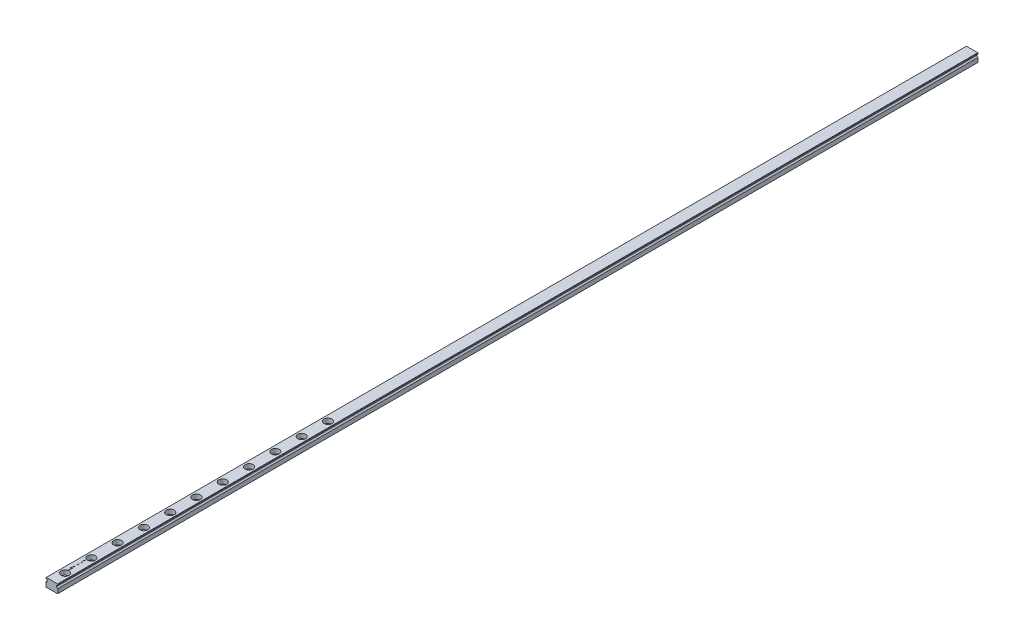
from build123d import *

# Parameters (mm, degrees)
EXTRUDE_1_DEPTH              = 220
HOLE_WIZARD_M3_1_D           = 3.5
HOLE_WIZARD_M3_1_CBORE_D     = 6
HOLE_WIZARD_M3_1_CBORE_DEPTH = 3.5
PATTERN_LINEAR_1_COUNT       = 11
PATTERN_LINEAR_1_PITCH       = 20
SKETCH_6_W                   = 1.5
SKETCH_6_H                   = 0.134615385
CUT_EXTRUDE_1_DEPTH          = 0.1
EXTRUDE_2_DEPTH              = 480


with BuildPart() as part:
    # 草图1 → 凸台-拉伸1 (new body)
    with BuildSketch(Plane.XY):
        with BuildLine():
            Line((4.5, 5.5), (4.5, 6.3))
            Line((4.5, 6.3), (4.3, 6.5))
            Line((4.3, 6.5), (-4.3, 6.5))
            Line((-4.3, 6.5), (-4.5, 6.3))
            Line((-4.5, 6.3), (-4.5, 5.5))
            ThreePointArc((-4.5, 5.5), (-3.5, 4.5), (-4.5, 3.5))
            Line((-4.5, 3.5), (-4.5, 0.2))
            Line((-4.5, 0.2), (-4.3, 0))
            Line((-4.3, 0), (0.2, 0))
            ThreePointArc((0.2, 0), (0.5, 0.3), (0.8, 0))
            Line((0.8, 0), (4.3, 0))
            Line((4.3, 0), (4.5, 0.2))
            Line((4.5, 0.2), (4.5, 3.5))
            ThreePointArc((4.5, 3.5), (3.5, 4.5), (4.5, 5.5))
        make_face()
    extrude(amount=-EXTRUDE_1_DEPTH)

    # M3 六角凹头螺钉的柱形沉头孔1 (through all)
    with Locations(Plane(origin=(0.754900713, 6.5, 19.343475793), x_dir=(-1, 0, 0), z_dir=(0, 1, 0))):
        with Locations((0.754900713, -29.343475793)):
            hole_wizard_m3_1 = CounterBoreHole(HOLE_WIZARD_M3_1_D / 2, HOLE_WIZARD_M3_1_CBORE_D / 2, HOLE_WIZARD_M3_1_CBORE_DEPTH)

    # 阵列(线性)1: M3 六角凹头螺钉的柱形沉头孔1 ×11
    with Locations(*[(0, 0, -i * PATTERN_LINEAR_1_PITCH) for i in range(1, PATTERN_LINEAR_1_COUNT)]):
        add(hole_wizard_m3_1, mode=Mode.SUBTRACT)

    # 草图6 → 切除-拉伸1 (cut)
    # profile 1 of 9: a face of its own
    with BuildSketch(Plane(origin=(0, 6.5, 0), x_dir=(1, 0, 0), z_dir=(0, 1, 0))):
        Polygon((-1.5, 13.740384615), (-1.5, 13.875), (-0.884615385, 13.875), (-0.884615385, 14.644230769), (-1.5, 14.644230769), (-1.5, 14.778846154), (0, 14.778846154), (0, 14.644230769), (-0.730769231, 14.644230769), (-0.730769231, 13.875), (0, 13.875), (0, 13.740384615), align=None)
    # profile 2 of 9: a face of its own
    with BuildSketch(Plane(origin=(0, 6.5, 0), x_dir=(1, 0, 0), z_dir=(0, 1, 0))):
        with Locations((-0.75, 15.230769231)):
            Rectangle(SKETCH_6_W, SKETCH_6_H)
    # profile 3 of 9: a face of its own
    with BuildSketch(Plane(origin=(0, 6.5, 0), x_dir=(1, 0, 0), z_dir=(0, 1, 0))):
        Polygon((-1.5, 15.528846154), (-1.5, 15.66796875), (-0.399939904, 15.961538462), (-1.5, 16.398137019), (-1.5, 16.417668269), (-0.407451923, 16.846153846), (-1.5, 17.141225962), (-1.5, 17.278846154), (0, 16.874399038), (0, 16.855168269), (-1.147235577, 16.403846154), (0, 15.947115385), (0, 15.927884615), align=None)
    # profile 4 of 9: a face of its own
    with BuildSketch(Plane(origin=(0, 6.5, 0), x_dir=(1, 0, 0), z_dir=(0, 1, 0))):
        with Locations((-0.75, 17.692307693)):
            Rectangle(SKETCH_6_W, SKETCH_6_H)
    # profile 5 of 9: a face of its own
    with BuildSketch(Plane(origin=(0, 6.5, 0), x_dir=(1, 0, 0), z_dir=(0, 1, 0))):
        Polygon((0, 18.086538462), (-1.5, 18.086538462), (-1.5, 18.114783654), (-0.319411058, 19.105769231), (-1.5, 19.105769231), (-1.5, 19.240384615), (0, 19.240384615), (0, 19.209735577), (-1.177884615, 18.221153846), (0, 18.221153846), align=None)
    # profile 6 of 9: a face of its own
    with BuildSketch(Plane(origin=(0, 6.5, 0), x_dir=(1, 0, 0), z_dir=(0, 1, 0))):
        Polygon((0, 20.125), (-1.5, 20.323016827), (-1.5, 20.342247596), (-0.269230769, 20.961538462), (-1.5, 21.579326923), (-1.5, 21.598858173), (0, 21.798076923), (0, 21.662860577), (-1.079326923, 21.519230769), (0, 20.977764423), (0, 20.947415865), (-1.081730769, 20.403846154), (0, 20.260516827), align=None)
    # profile 7 of 9: a face of its own
    with BuildSketch(Plane(origin=(0, 6.5, 0), x_dir=(1, 0, 0), z_dir=(0, 1, 0))):
        with BuildLine():
            Line((-1.243990385, 23.509615385), (-1.134615385, 23.394230769))
            add(Edge.make_bspline(
                [(-1.134615385, 23.394230769), (-1.154263766, 23.373355449), (-1.193092001, 23.332102593), (-1.243390317, 23.264731189), (-1.28690443, 23.194721537), (-1.322045397, 23.121960438), (-1.349611823, 23.048355866), (-1.369650093, 22.975173457), (-1.382340162, 22.902887044), (-1.383864341, 22.854816629), (-1.384615385, 22.831129808)],
                knots=[0, 0, 0, 0, 1.089067066, 2.152164705, 3.18986567, 4.218445106, 5.218487318, 6.173592265, 7.100032889, 8, 8, 8, 8], degree=3))
            add(Edge.make_bspline(
                [(-1.384615385, 22.831129808), (-1.384438125, 22.816594936), (-1.384084065, 22.78756289), (-1.379565116, 22.7444392), (-1.373065889, 22.701767784), (-1.363662227, 22.659629195), (-1.351744059, 22.6179415), (-1.336836002, 22.576849691), (-1.319455188, 22.536277104), (-1.299371251, 22.496605953), (-1.277308532, 22.458145638), (-1.252858892, 22.42182164), (-1.226807524, 22.387400299), (-1.198496406, 22.355536353), (-1.168203133, 22.326017847), (-1.136473262, 22.298301833), (-1.102682945, 22.272904871), (-1.066971137, 22.250282454), (-1.030168657, 22.229853485), (-0.992587626, 22.212199685), (-0.954576919, 22.196852561), (-0.915850319, 22.185163721), (-0.876807084, 22.175263346), (-0.837242608, 22.168371388), (-0.797053572, 22.164472967), (-0.770140273, 22.163799899), (-0.756610577, 22.163461538)],
                knots=[0, 0, 0, 0, 1.028150113, 2.053633673, 3.06513288, 4.081487945, 5.106702018, 6.131327874, 7.172780699, 8.228344599, 9.276313556, 10.308389736, 11.324843658, 12.329040066, 13.321460474, 14.316307835, 15.308626991, 16.309440696, 17.305625405, 18.28535951, 19.246194545, 20.203493668, 21.145557131, 22.095268976, 23.042464743, 24, 24, 24, 24], degree=3))
            add(Edge.make_bspline(
                [(-0.756610577, 22.163461538), (-0.742780294, 22.163785622), (-0.715157493, 22.164432905), (-0.673930463, 22.168569989), (-0.633320499, 22.176265079), (-0.593263727, 22.186470115), (-0.553680426, 22.199444118), (-0.514611904, 22.215383767), (-0.476061961, 22.23437211), (-0.438413282, 22.256302653), (-0.401770368, 22.280520997), (-0.36696502, 22.307157219), (-0.334402283, 22.336256163), (-0.303606537, 22.367284281), (-0.274772132, 22.40052428), (-0.248246624, 22.43629865), (-0.223619847, 22.474106619), (-0.201162346, 22.513964957), (-0.181102046, 22.555452377), (-0.163263098, 22.597990847), (-0.14857199, 22.641717091), (-0.136598507, 22.686401091), (-0.126784097, 22.731989638), (-0.120470176, 22.778714125), (-0.115888391, 22.826231), (-0.11555339, 22.858261842), (-0.115384615, 22.874399038)],
                knots=[0, 0, 0, 0, 0.935915162, 1.869274651, 2.799799983, 3.730201895, 4.664668062, 5.616159355, 6.583070886, 7.570012957, 8.562524459, 9.553461134, 10.53281078, 11.515274572, 12.509912756, 13.507571325, 14.526460018, 15.561318395, 16.601025881, 17.643204557, 18.680545676, 19.719612342, 20.772381578, 21.833430283, 22.908478249, 24, 24, 24, 24], degree=3))
            add(Edge.make_bspline(
                [(-0.115384615, 22.874399038), (-0.11579098, 22.893846981), (-0.116588941, 22.932036175), (-0.122805743, 22.988172098), (-0.132502802, 23.042091792), (-0.14674811, 23.093619722), (-0.164779159, 23.142942891), (-0.187077122, 23.189879386), (-0.213407387, 23.234558812), (-0.24323677, 23.276787781), (-0.276471827, 23.315562361), (-0.312015273, 23.350851823), (-0.350327601, 23.381442662), (-0.390837822, 23.408248655), (-0.433933425, 23.430404616), (-0.479374666, 23.448595707), (-0.527189663, 23.462538188), (-0.560228886, 23.468261798), (-0.576923077, 23.471153846)],
                knots=[0, 0, 0, 0, 1.130199668, 2.219330667, 3.279027493, 4.311506524, 5.322739849, 6.327972234, 7.327472899, 8.33386792, 9.329086447, 10.29244429, 11.240784345, 12.174119183, 13.111530729, 14.052100829, 15.015757696, 16, 16, 16, 16], degree=3))
            Line((-0.576923077, 23.471153846), (-0.576923077, 22.971153846))
            Line((-0.576923077, 22.971153846), (-0.730769231, 22.971153846))
            Line((-0.730769231, 22.971153846), (-0.730769231, 23.605769231))
            add(Edge.make_bspline(
                [(-0.730769231, 23.605769231), (-0.702094593, 23.605038153), (-0.645973146, 23.603607301), (-0.564128744, 23.593570623), (-0.48682659, 23.577363547), (-0.413985274, 23.555223413), (-0.34570802, 23.526562579), (-0.281925506, 23.491688638), (-0.223049785, 23.450043443), (-0.168600212, 23.403110397), (-0.12003055, 23.350438986), (-0.077342291, 23.293452435), (-0.041384027, 23.232056591), (-0.012129457, 23.166309531), (0.010702255, 23.096426488), (0.026890073, 23.022245754), (0.036588629, 22.943867925), (0.037827792, 22.890152206), (0.038461538, 22.862680288)],
                knots=[0, 0, 0, 0, 1.140356446, 2.231883559, 3.274166699, 4.278491846, 5.25512956, 6.21435461, 7.1637429, 8.11826594, 9.068280886, 10.0076534, 10.945064095, 11.891975133, 12.864533718, 13.863980011, 14.907571808, 16, 16, 16, 16], degree=3))
            add(Edge.make_bspline(
                [(0.038461538, 22.862680288), (0.038217629, 22.845747373), (0.037736562, 22.812350207), (0.034317699, 22.763025524), (0.029054595, 22.715060829), (0.021106685, 22.668463111), (0.011371833, 22.623060964), (-0.001093904, 22.579081142), (-0.015523346, 22.53635611), (-0.031935778, 22.494819831), (-0.050952202, 22.45484931), (-0.072084905, 22.416266517), (-0.095224917, 22.378858178), (-0.120772422, 22.342879107), (-0.148536333, 22.308141841), (-0.178572299, 22.274870365), (-0.210788493, 22.242878417), (-0.233665211, 22.222838219), (-0.245192308, 22.212740385)],
                knots=[0, 0, 0, 0, 1.107784379, 2.184907829, 3.233506516, 4.263428166, 5.276301166, 6.270063455, 7.25232949, 8.225834625, 9.190232166, 10.146266622, 11.1027726, 12.066435141, 13.031522626, 14.010570082, 14.99756817, 16, 16, 16, 16], degree=3))
            add(Edge.make_bspline(
                [(-0.245192308, 22.212740385), (-0.26347973, 22.198089271), (-0.299751023, 22.169030237), (-0.357865285, 22.131625313), (-0.418037511, 22.099738997), (-0.480435209, 22.073867073), (-0.545000015, 22.053665036), (-0.611649425, 22.039176642), (-0.680469267, 22.030687804), (-0.727040094, 22.02946486), (-0.750600962, 22.028846154)],
                knots=[0, 0, 0, 0, 1.023165419, 2.029347347, 3.013907458, 3.994755782, 4.975994455, 5.96558838, 6.970761222, 8, 8, 8, 8], degree=3))
            add(Edge.make_bspline(
                [(-0.750600962, 22.028846154), (-0.768243641, 22.029074256), (-0.803304773, 22.029527561), (-0.855357904, 22.035024211), (-0.906486775, 22.042910531), (-0.956649576, 22.054502135), (-1.005879862, 22.069114786), (-1.054200296, 22.087352121), (-1.101640133, 22.108585168), (-1.147870041, 22.133266476), (-1.192287019, 22.160724506), (-1.234673706, 22.190556358), (-1.274343142, 22.222992223), (-1.311387223, 22.258126549), (-1.346354989, 22.295251091), (-1.378516018, 22.33514522), (-1.408373576, 22.377204507), (-1.435353952, 22.421754996), (-1.459597318, 22.468093695), (-1.480849352, 22.516119874), (-1.498413761, 22.565816082), (-1.513316774, 22.616810749), (-1.524337558, 22.669489669), (-1.532329875, 22.723470616), (-1.537798704, 22.779034949), (-1.538238528, 22.816593247), (-1.538461538, 22.835637019)],
                knots=[0, 0, 0, 0, 1.00895651, 2.005089799, 2.991467152, 3.967318338, 4.948153826, 5.927364234, 6.919980553, 7.91976625, 8.923240147, 9.905815003, 10.88314567, 11.851989312, 12.825009789, 13.798721852, 14.781296708, 15.773896486, 16.776076962, 17.771600213, 18.775744723, 19.78957137, 20.808953803, 21.851964491, 22.910847925, 24, 24, 24, 24], degree=3))
            add(Edge.make_bspline(
                [(-1.538461538, 22.835637019), (-1.538213185, 22.851167695), (-1.537720729, 22.8819632), (-1.534307308, 22.927788514), (-1.528897073, 22.97290552), (-1.521514165, 23.017381116), (-1.511458298, 23.061063844), (-1.499424747, 23.104078147), (-1.485413966, 23.146486377), (-1.46870446, 23.188155626), (-1.449738621, 23.229366076), (-1.428390011, 23.270346865), (-1.404293581, 23.31095797), (-1.37737778, 23.351269819), (-1.348104887, 23.391536616), (-1.315637676, 23.431121462), (-1.281256495, 23.470979867), (-1.256535559, 23.496609216), (-1.243990385, 23.509615385)],
                knots=[0, 0, 0, 0, 0.985871117, 1.954866573, 2.915460327, 3.869826059, 4.81536089, 5.759505086, 6.70452669, 7.649098992, 8.607881297, 9.583363685, 10.581137262, 11.603961102, 12.659522466, 13.73993555, 14.853081303, 16, 16, 16, 16], degree=3))
        make_face()
    # profile 8 of 9: a face of its own
    with BuildSketch(Plane(origin=(0, 6.5, 0), x_dir=(1, 0, 0), z_dir=(0, 1, 0))):
        Polygon((0, 23.913461538), (-1.5, 23.913461538), (-1.5, 23.941706731), (-0.319411058, 24.932692308), (-1.5, 24.932692308), (-1.5, 25.067307692), (0, 25.067307692), (0, 25.036658654), (-1.177884615, 24.048076923), (0, 24.048076923), align=None)
    # profile 9 of 9: a face of its own
    with BuildSketch(Plane(origin=(0, 6.5, 0), x_dir=(1, 0, 0), z_dir=(0, 1, 0))):
        with BuildLine():
            Line((0.038461538, 25.644230769), (-0.036358173, 25.536658654))
            Line((-0.036358173, 25.536658654), (-0.646033654, 25.953725962))
            add(Edge.make_bspline(
                [(-0.646033654, 25.953725962), (-0.642627639, 25.927119325), (-0.635922786, 25.874743285), (-0.635046516, 25.821948826), (-0.634615385, 25.795973558)],
                knots=[0, 0, 0, 0, 1.015985029, 2, 2, 2, 2], degree=3))
            add(Edge.make_bspline(
                [(-0.634615385, 25.795973558), (-0.635018703, 25.780226966), (-0.635810382, 25.749317783), (-0.642085443, 25.703875646), (-0.651749784, 25.660210407), (-0.666170676, 25.61843782), (-0.684092777, 25.578400913), (-0.706317169, 25.540186946), (-0.732462883, 25.503847908), (-0.762390698, 25.469771994), (-0.79525498, 25.438786105), (-0.830027824, 25.411158608), (-0.867084601, 25.38832306), (-0.905643777, 25.369014905), (-0.946528356, 25.354782526), (-0.989044603, 25.344167996), (-1.033456433, 25.33770465), (-1.063680548, 25.336931181), (-1.079026442, 25.336538462)],
                knots=[0, 0, 0, 0, 1.060698949, 2.082059282, 3.085738422, 4.069684654, 5.054463875, 6.037298355, 7.043153692, 8.066652628, 9.088369706, 10.083456696, 11.053578809, 12.016466116, 12.983507685, 13.964045196, 14.966270913, 16, 16, 16, 16], degree=3))
            add(Edge.make_bspline(
                [(-1.079026442, 25.336538462), (-1.100012199, 25.337283285), (-1.141202981, 25.338745222), (-1.201400397, 25.350466182), (-1.258351131, 25.369885651), (-1.3119915, 25.396537862), (-1.361089385, 25.43075081), (-1.405478439, 25.47138122), (-1.444366827, 25.518757479), (-1.477757084, 25.571642671), (-1.504794475, 25.628718475), (-1.524003389, 25.688742519), (-1.536274492, 25.750703662), (-1.537729379, 25.792811829), (-1.538461538, 25.814002404)],
                knots=[0, 0, 0, 0, 1.023011052, 2.007963168, 2.978169221, 3.950402619, 4.919353283, 5.887490769, 6.876420893, 7.899700203, 8.931203047, 9.947778163, 10.96723692, 12, 12, 12, 12], degree=3))
            add(Edge.make_bspline(
                [(-1.538461538, 25.814002404), (-1.537677179, 25.834783148), (-1.536127357, 25.875843941), (-1.524777147, 25.936225043), (-1.505646911, 25.994056533), (-1.479211547, 26.04902008), (-1.446070758, 26.099903164), (-1.406596454, 26.145683388), (-1.360755672, 26.185145911), (-1.309807647, 26.21879079), (-1.25472961, 26.245295182), (-1.197347446, 26.264716171), (-1.138006313, 26.276587527), (-1.097810064, 26.2780886), (-1.077524038, 26.278846154)],
                knots=[0, 0, 0, 0, 1.026358223, 2.027987109, 3.023239252, 4.028077889, 5.032770297, 6.015020143, 7.004250571, 8.011656937, 9.02310243, 10.015224881, 10.998334443, 12, 12, 12, 12], degree=3))
            add(Edge.make_bspline(
                [(-1.077524038, 26.278846154), (-1.061777289, 26.278338872), (-1.029838946, 26.277309978), (-0.981399024, 26.270187018), (-0.932048608, 26.257900384), (-0.890237555, 26.244171772), (-0.855599349, 26.230715419), (-0.828157364, 26.218414328), (-0.799474135, 26.204124912), (-0.769432207, 26.188166246), (-0.737992383, 26.170568563), (-0.705372722, 26.150853478), (-0.671525668, 26.129286907), (-0.648704972, 26.113932306), (-0.637019231, 26.106069712)],
                knots=[0, 0, 0, 0, 1.179894106, 2.393120058, 3.660107319, 4.986885617, 5.687958251, 6.443931318, 7.239444731, 8.088894906, 8.992865148, 9.938946712, 10.944601238, 12, 12, 12, 12], degree=3))
            Line((-0.637019231, 26.106069712), (0.038461538, 25.644230769))
        make_face()
        with BuildLine():
            add(Edge.make_bspline(
                [(-0.788461538, 25.820913462), (-0.788788092, 25.832842038), (-0.789423782, 25.856062922), (-0.793275522, 25.890085737), (-0.800155229, 25.922181807), (-0.809870336, 25.952557703), (-0.822177437, 25.981176653), (-0.837175655, 26.008047671), (-0.855193568, 26.032896281), (-0.875446063, 26.05581095), (-0.897641992, 26.076606708), (-0.92142287, 26.094537445), (-0.946049906, 26.110062218), (-0.972027251, 26.122447516), (-0.998929945, 26.132428799), (-1.027147055, 26.139393389), (-1.056483756, 26.143240028), (-1.076411522, 26.143896939), (-1.086538462, 26.144230769)],
                knots=[0, 0, 0, 0, 1.163726718, 2.265380301, 3.334713825, 4.36057981, 5.371541381, 6.368955992, 7.355979581, 8.359691305, 9.348261197, 10.317521986, 11.261029684, 12.183096459, 13.119698615, 14.055740009, 15.011961376, 16, 16, 16, 16], degree=3))
            add(Edge.make_bspline(
                [(-1.086538462, 26.144230769), (-1.096669885, 26.143944046), (-1.116635099, 26.143379024), (-1.146011565, 26.138837612), (-1.174173238, 26.130870253), (-1.201311834, 26.120071794), (-1.227278993, 26.10611642), (-1.252156559, 26.089207568), (-1.27556797, 26.06878977), (-1.297899065, 26.04597379), (-1.318157147, 26.020878942), (-1.336055672, 25.994290795), (-1.351161049, 25.966351386), (-1.363089133, 25.93693608), (-1.37286104, 25.906444325), (-1.379778661, 25.87456046), (-1.383632614, 25.841240421), (-1.384283622, 25.818619358), (-1.384615385, 25.807091346)],
                knots=[0, 0, 0, 0, 0.971910406, 1.91526867, 2.84337505, 3.775008003, 4.712374136, 5.666733183, 6.654995996, 7.688089235, 8.726800303, 9.745078658, 10.75990398, 11.768337501, 12.786615857, 13.829099629, 14.893678693, 16, 16, 16, 16], degree=3))
            add(Edge.make_bspline(
                [(-1.384615385, 25.807091346), (-1.384283077, 25.795663594), (-1.383631091, 25.773242439), (-1.379786064, 25.740218598), (-1.372814047, 25.708550372), (-1.363093561, 25.678147127), (-1.351160136, 25.648732673), (-1.336054875, 25.620794582), (-1.318161301, 25.594200241), (-1.297882935, 25.569129265), (-1.275672102, 25.546272163), (-1.252051947, 25.526199864), (-1.227292163, 25.509252774), (-1.201308356, 25.495316895), (-1.174174163, 25.48451328), (-1.146011315, 25.476547297), (-1.116635164, 25.472005515), (-1.096669907, 25.471440543), (-1.086538462, 25.471153846)],
                knots=[0, 0, 0, 0, 1.099107991, 2.156440826, 3.191784126, 4.212280276, 5.222910149, 6.239945746, 7.260441896, 8.30141526, 9.33675856, 10.320924759, 11.277362386, 12.216770088, 13.150432123, 14.080559904, 15.025972789, 16, 16, 16, 16], degree=3))
            add(Edge.make_bspline(
                [(-1.086538462, 25.471153846), (-1.076403667, 25.471413811), (-1.056415996, 25.471926509), (-1.02704542, 25.476862927), (-0.998901248, 25.485140198), (-0.971743232, 25.496115903), (-0.945922725, 25.510845615), (-0.921305837, 25.528746476), (-0.897389308, 25.549401013), (-0.875515463, 25.573486122), (-0.855096635, 25.599349364), (-0.837288944, 25.627129241), (-0.822356647, 25.656267501), (-0.809834058, 25.686577057), (-0.800253227, 25.718284705), (-0.793288301, 25.751346293), (-0.789460709, 25.785767775), (-0.788797791, 25.809085836), (-0.788461538, 25.820913462)],
                knots=[0, 0, 0, 0, 0.952872936, 1.879239831, 2.791748947, 3.708674669, 4.628500839, 5.580394867, 6.568761142, 7.595635223, 8.636123962, 9.665976811, 10.694276597, 11.712685318, 12.747011694, 13.805940053, 14.887106426, 16, 16, 16, 16], degree=3))
        make_face(mode=Mode.SUBTRACT)
    extrude(amount=-CUT_EXTRUDE_1_DEPTH, mode=Mode.SUBTRACT)

    # 草图7 → 凸台-拉伸2 (add)
    with BuildSketch(Plane(origin=(0, 0, -220), x_dir=(-1, 0, 0), z_dir=(0, 0, -1))):
        with BuildLine():
            Line((-4.3, 0), (-0.8, 0))
            ThreePointArc((-0.8, 0), (-0.5, 0.3), (-0.2, 0))
            Line((-0.2, 0), (4.3, 0))
            Line((4.3, 0), (4.5, 0.2))
            Line((4.5, 0.2), (4.5, 3.5))
            ThreePointArc((4.5, 3.5), (3.5, 4.5), (4.5, 5.5))
            Line((4.5, 5.5), (4.5, 6.3))
            Line((4.5, 6.3), (4.3, 6.5))
            Line((4.3, 6.5), (-4.3, 6.5))
            Line((-4.3, 6.5), (-4.5, 6.3))
            Line((-4.5, 6.3), (-4.5, 5.5))
            ThreePointArc((-4.5, 5.5), (-3.5, 4.5), (-4.5, 3.5))
            Line((-4.5, 3.5), (-4.5, 0.2))
            Line((-4.5, 0.2), (-4.3, 0))
        make_face()
    extrude(amount=EXTRUDE_2_DEPTH)


solid = part.part
